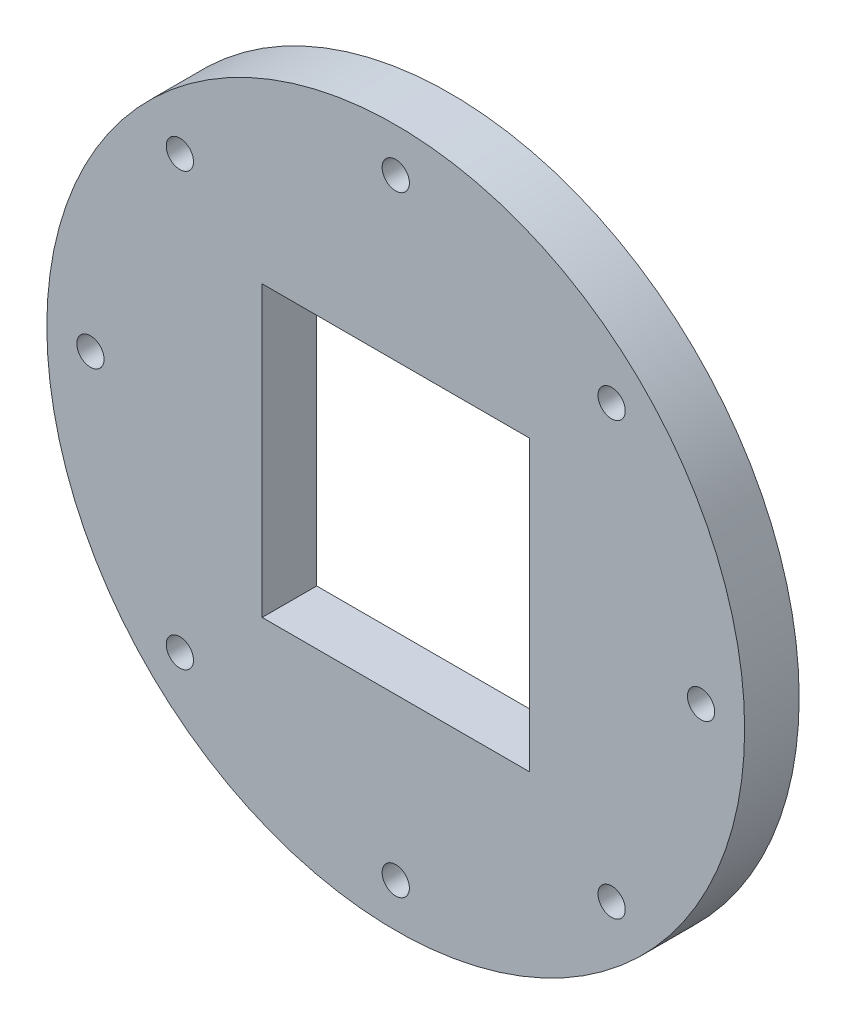
from build123d import *

# Parameters (mm, degrees)
CROQUIS1_R              = 32
SALIENTE_EXTRUIR1_DEPTH = 5
CROQUIS2_R              = 1.25
CORTAR_EXTRUIR1_DEPTH   = 46.530209751
CROQUIS3_W              = 24.5
CROQUIS3_H              = 26.5
CORTAR_EXTRUIR2_DEPTH   = 10


with BuildPart() as part:
    # Croquis1 → Saliente-Extruir1 (new body)
    with BuildSketch(Plane.XY):
        Circle(CROQUIS1_R)
    extrude(amount=SALIENTE_EXTRUIR1_DEPTH)

    # Croquis2 → Cortar-Extruir1 (cut, through all)
    with BuildSketch(Plane.XY.offset(5)):
        with Locations((0, 28)):
            Circle(CROQUIS2_R)
        with Locations((19.798989873, 19.798989873)):
            Circle(CROQUIS2_R)
        with Locations((28, 0)):
            Circle(CROQUIS2_R)
        with Locations((19.798989873, -19.798989873)):
            Circle(CROQUIS2_R)
        with Locations((0, -28)):
            Circle(CROQUIS2_R)
        with Locations((-19.798989873, -19.798989873)):
            Circle(CROQUIS2_R)
        with Locations((-28, 0)):
            Circle(CROQUIS2_R)
        with Locations((-19.798989873, 19.798989873)):
            Circle(CROQUIS2_R)
    extrude(amount=-CORTAR_EXTRUIR1_DEPTH, mode=Mode.SUBTRACT)

    # Croquis3 → Cortar-Extruir2 (cut)
    with BuildSketch(Plane.XY.offset(5)):
        Rectangle(CROQUIS3_W, CROQUIS3_H)
    extrude(amount=-CORTAR_EXTRUIR2_DEPTH, mode=Mode.SUBTRACT)


solid = part.part
